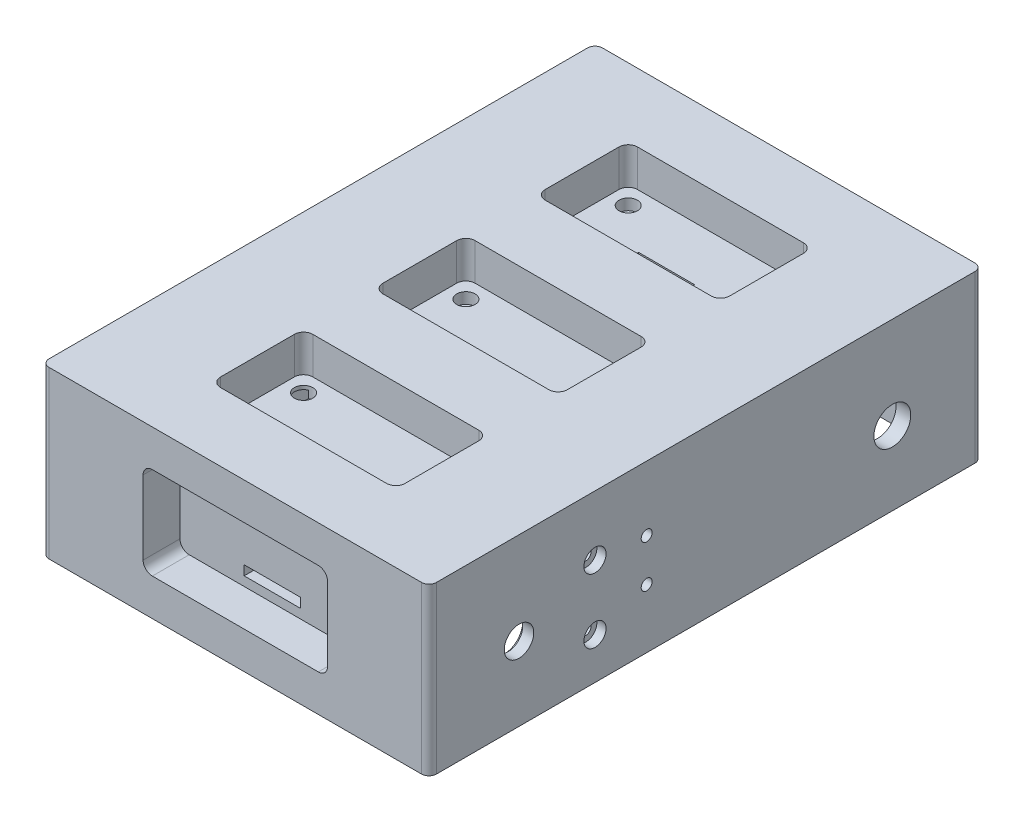
from build123d import *

# Parameters (mm, degrees)
SKETCH_1_W           = 105
SKETCH_1_H           = 150
EXTRUDE_1_DEPTH      = 45
CUT_EXTRUDE_1_DEPTH  = 10
CUT_EXTRUDE_2_DEPTH  = 10
SHELL_1_T            = -4
SKETCH_5_R           = 1.45
SKETCH_5_R_2         = 4
SKETCH_5_R_3         = 5
CUT_EXTRUDE_3_DEPTH  = 15
SKETCH_6_R           = 3
CUT_EXTRUDE_4_DEPTH  = 2.5
CUT_EXTRUDE_START    = -3
SKETCH_10_W          = 5
SKETCH_10_H          = 36.5
CUT_EXTRUDE_15_DEPTH = 100.655315425
SKETCH_11_R          = 5
CUT_EXTRUDE_16_DEPTH = 1
SKETCH_12_R          = 1.45
CUT_EXTRUDE_17_DEPTH = 14
SKETCH_25_W          = 25
SKETCH_25_H          = 11
EXTRUDE_2_DEPTH      = 10
SKETCH_13_R          = 1.45
CUT_EXTRUDE_18_DEPTH = 10
SKETCH_14_R          = 1.45
CUT_EXTRUDE_19_DEPTH = 3
SKETCH_15_R          = 2.5
SKETCH_15_W          = 15.2
SKETCH_15_H          = 2.6
CUT_EXTRUDE_20_DEPTH = 3
SKETCH_16_W          = 14
SKETCH_16_H          = 1.8
CUT_EXTRUDE_21_DEPTH = 3
SKETCH_17_R          = 2.5
SKETCH_17_W          = 15.2
SKETCH_17_H          = 2.6
CUT_EXTRUDE_22_DEPTH = 3
SKETCH_18_W          = 14
SKETCH_18_H          = 1.8
CUT_EXTRUDE_23_DEPTH = 3
SKETCH_19_R          = 2.5
SKETCH_19_W          = 15.2
SKETCH_19_H          = 2.6
CUT_EXTRUDE_24_DEPTH = 3
SKETCH_20_W          = 14
SKETCH_20_H          = 1.8
CUT_EXTRUDE_25_DEPTH = 8
SKETCH_21_W          = 9.5
SKETCH_21_H          = 14.5
CUT_EXTRUDE_26_DEPTH = 4
SKETCH_22_R          = 1.425
CUT_EXTRUDE_27_DEPTH = 9
SKETCH_24_R          = 1.475
CUT_EXTRUDE_28_DEPTH = 137.656503687
FILLET_1_R           = 2


with BuildPart() as part:
    # Эскиз1 → Бобышка-Вытянуть1 (new body)
    with BuildSketch(Plane(origin=(0, 0, 0), x_dir=(1, 0, 0), z_dir=(0, 1, 0))):
        Rectangle(SKETCH_1_W, SKETCH_1_H)
    extrude(amount=EXTRUDE_1_DEPTH)

    # Эскиз2 → Вырез-Вытянуть1 (cut)
    with BuildSketch(Plane.XY.offset(75)):
        with BuildLine():
            Line((-22.5, 10), (22.5, 10))
            ThreePointArc((22.5, 10), (24.267766953, 10.732233047), (25, 12.5))
            Line((25, 12.5), (25, 32.5))
            ThreePointArc((25, 32.5), (24.267766953, 34.267766953), (22.5, 35))
            Line((22.5, 35), (-22.5, 35))
            ThreePointArc((-22.5, 35), (-24.267766953, 34.267766953), (-25, 32.5))
            Line((-25, 32.5), (-25, 12.5))
            ThreePointArc((-25, 12.5), (-24.267766953, 10.732233047), (-22.5, 10))
        make_face()
    cut_extrude_1 = extrude(amount=-CUT_EXTRUDE_1_DEPTH, mode=Mode.SUBTRACT)

    # Эскиз4 → Вырез-Вытянуть2 (cut)
    with BuildSketch(Plane(origin=(0, 45, 0), x_dir=(1, 0, 0), z_dir=(0, 1, 0))):
        with BuildLine():
            Line((-22.5, 31.5), (22.5, 31.5))
            ThreePointArc((22.5, 31.5), (24.267766953, 32.232233047), (25, 34))
            Line((25, 34), (25, 54))
            ThreePointArc((25, 54), (24.267766953, 55.767766953), (22.5, 56.5))
            Line((22.5, 56.5), (-22.5, 56.5))
            ThreePointArc((-22.5, 56.5), (-24.267766953, 55.767766953), (-25, 54))
            Line((-25, 54), (-25, 34))
            ThreePointArc((-25, 34), (-24.267766953, 32.232233047), (-22.5, 31.5))
        make_face()
        with BuildLine():
            Line((-22.5, -12.5), (22.5, -12.5))
            ThreePointArc((22.5, -12.5), (24.267766953, -11.767766953), (25, -10))
            Line((25, -10), (25, 10))
            ThreePointArc((25, 10), (24.267766953, 11.767766953), (22.5, 12.5))
            Line((22.5, 12.5), (-22.5, 12.5))
            ThreePointArc((-22.5, 12.5), (-24.267766953, 11.767766953), (-25, 10))
            Line((-25, 10), (-25, -10))
            ThreePointArc((-25, -10), (-24.267766953, -11.767766953), (-22.5, -12.5))
        make_face()
        with BuildLine():
            Line((-22.5, -56.5), (22.5, -56.5))
            ThreePointArc((22.5, -56.5), (24.267766953, -55.767766953), (25, -54))
            Line((25, -54), (25, -34))
            ThreePointArc((25, -34), (24.267766953, -32.232233047), (22.5, -31.5))
            Line((22.5, -31.5), (-22.5, -31.5))
            ThreePointArc((-22.5, -31.5), (-24.267766953, -32.232233047), (-25, -34))
            Line((-25, -34), (-25, -54))
            ThreePointArc((-25, -54), (-24.267766953, -55.767766953), (-22.5, -56.5))
        make_face()
    extrude(amount=-CUT_EXTRUDE_2_DEPTH, mode=Mode.SUBTRACT)

    # Зеркальное отражение1: Вырез-Вытянуть1 across plane
    add(cut_extrude_1.mirror(Plane.XY), mode=Mode.SUBTRACT)

    # Оболочка1
    shell_1_openings = [part.faces().sort_by_distance(p)[0] for p in [
        (0, 0, 0),
    ]]
    offset(amount=SHELL_1_T, openings=shell_1_openings, kind=Kind.INTERSECTION)

    # Эскиз5 → Вырез-Вытянуть3 (cut)
    with BuildSketch(Plane.ZY.offset(52.5)):
        with Locations((30, 28.75)):
            Circle(SKETCH_5_R)
        with Locations((30, 11.25)):
            Circle(SKETCH_5_R)
        with Locations((50.6, 20)):
            Circle(SKETCH_5_R_2)
        with Locations((-50.6, 20)):
            Circle(SKETCH_5_R_3)
    cut_extrude_3 = extrude(amount=-CUT_EXTRUDE_3_DEPTH, mode=Mode.SUBTRACT)

    # Эскиз6 → Вырез-Вытянуть4 (cut)
    with BuildSketch(Plane.ZY.offset(52.5)):
        with Locations((30, 28.75)):
            Circle(SKETCH_6_R)
        with Locations((30, 11.25)):
            Circle(SKETCH_6_R)
    cut_extrude_4 = extrude(amount=-CUT_EXTRUDE_4_DEPTH, mode=Mode.SUBTRACT)

    # Эскиз10 → Вырез-Вытянуть15 (cut)
    with BuildSketch(Plane(origin=(0, 31, 0), x_dir=(-1, 0, 0), z_dir=(0, -1, 0)).offset(CUT_EXTRUDE_START)):
        with Locations((23.5, -45.75)):
            Rectangle(SKETCH_10_W, SKETCH_10_H)
    cut_extrude_15 = extrude(amount=CUT_EXTRUDE_15_DEPTH, mode=Mode.SUBTRACT)

    # Эскиз11 → Вырез-Вытянуть16 (cut)
    with BuildSketch(Plane(origin=(-48.5, 0, 0), x_dir=(0, 0, -1), z_dir=(1, 0, 0))):
        with Locations((-50.6, 20)):
            Circle(SKETCH_11_R)
    cut_extrude_16 = extrude(amount=-CUT_EXTRUDE_16_DEPTH, mode=Mode.SUBTRACT)

    # Зеркальное отражение2: Вырез-Вытянуть3, Вырез-Вытянуть4, Вырез-Вытянуть15, Вырез-Вытянуть16 across plane
    add(cut_extrude_3.mirror(Plane(origin=(0, 0, 0), x_dir=(0, 0, 1), z_dir=(1, 0, 0))), mode=Mode.SUBTRACT)
    add(cut_extrude_4.mirror(Plane(origin=(0, 0, 0), x_dir=(0, 0, 1), z_dir=(1, 0, 0))), mode=Mode.SUBTRACT)
    add(cut_extrude_15.mirror(Plane(origin=(0, 0, 0), x_dir=(0, 0, 1), z_dir=(1, 0, 0))), mode=Mode.SUBTRACT)
    add(cut_extrude_16.mirror(Plane(origin=(0, 0, 0), x_dir=(0, 0, 1), z_dir=(1, 0, 0))), mode=Mode.SUBTRACT)

    # Эскиз12 → Вырез-Вытянуть17 (cut)
    with BuildSketch(Plane(origin=(0, 6, 0), x_dir=(-1, 0, 0), z_dir=(0, -1, 0))):
        with Locations(Location((-10, -63, 0), (0, 0, 90))):
            Circle(SKETCH_12_R)
        with Locations(Location((10, -63, 0), (0, 0, 90))):
            Circle(SKETCH_12_R)
    extrude(amount=-CUT_EXTRUDE_17_DEPTH, mode=Mode.SUBTRACT)

    # Эскиз25 → Бобышка-Вытянуть2 (add)
    with BuildSketch(Plane.XZ.offset(-31)):
        with Locations((0, 22)):
            Rectangle(SKETCH_25_W, SKETCH_25_H)
    extrude(amount=-EXTRUDE_2_DEPTH)

    # Эскиз13 → Вырез-Вытянуть18 (cut)
    with BuildSketch(Plane(origin=(0, 31, 0), x_dir=(-1, 0, 0), z_dir=(0, -1, 0))):
        with Locations(Location((-9, -25.5, 0), (0, 0, 90))):
            Circle(SKETCH_13_R)
        with Locations(Location((9, -25.5, 0), (0, 0, 90))):
            Circle(SKETCH_13_R)
    extrude(amount=-CUT_EXTRUDE_18_DEPTH, mode=Mode.SUBTRACT)

    # Эскиз14 → Вырез-Вытянуть19 (cut)
    with BuildSketch(Plane(origin=(0, 31, 0), x_dir=(-1, 0, 0), z_dir=(0, -1, 0))):
        with Locations(Location((20, 47.5, 0), (0, 0, 90))):
            Circle(SKETCH_14_R)
        with Locations(Location((20, -7.5, 0), (0, 0, 90))):
            Circle(SKETCH_14_R)
        with Locations(Location((-20, -7.5, 0), (0, 0, 270))):
            Circle(SKETCH_14_R)
        with Locations(Location((-20, 47.5, 0), (0, 0, 270))):
            Circle(SKETCH_14_R)
    extrude(amount=-CUT_EXTRUDE_19_DEPTH, mode=Mode.SUBTRACT)

    # Эскиз15 → Вырез-Вытянуть20 (cut)
    with BuildSketch(Plane(origin=(0, 35, 0), x_dir=(1, 0, 0), z_dir=(0, 1, 0))):
        with Locations(Location((-20, -36.5, 0), (0, 0, 270))):
            Circle(SKETCH_15_R)
        with Locations(Location((20, -36.5, 0), (0, 0, 270))):
            Circle(SKETCH_15_R)
        with Locations(Location((-20, 7.5, 0), (0, 0, 270))):
            Circle(SKETCH_15_R)
        with Locations(Location((20, 7.5, 0), (0, 0, 270))):
            Circle(SKETCH_15_R)
        with Locations(Location((-20, 51.5, 0), (0, 0, 270))):
            Circle(SKETCH_15_R)
        with Locations(Location((20, 51.5, 0), (0, 0, 270))):
            Circle(SKETCH_15_R)
        with Locations((0, -54)):
            Rectangle(SKETCH_15_W, SKETCH_15_H)
        with Locations((0, -8.7)):
            Rectangle(SKETCH_15_W, SKETCH_15_H)
        with Locations((0, 36.6)):
            Rectangle(SKETCH_15_W, SKETCH_15_H)
        with Locations((0, -50)):
            Rectangle(SKETCH_15_W, SKETCH_15_H)
        with Locations((0, -4.7)):
            Rectangle(SKETCH_15_W, SKETCH_15_H)
        with Locations((0, 40.6)):
            Rectangle(SKETCH_15_W, SKETCH_15_H)
    extrude(amount=-CUT_EXTRUDE_20_DEPTH, mode=Mode.SUBTRACT)

    # Эскиз16 → Вырез-Вытянуть21 (cut)
    with BuildSketch(Plane(origin=(0, 32, 0), x_dir=(1, 0, 0), z_dir=(0, 1, 0))):
        with Locations((0, -54)):
            Rectangle(SKETCH_16_W, SKETCH_16_H)
        with Locations((0, -8.7)):
            Rectangle(SKETCH_16_W, SKETCH_16_H)
        with Locations((0, 36.6)):
            Rectangle(SKETCH_16_W, SKETCH_16_H)
        with Locations((0, -50)):
            Rectangle(SKETCH_16_W, SKETCH_16_H)
        with Locations((0, -4.7)):
            Rectangle(SKETCH_16_W, SKETCH_16_H)
        with Locations((0, 40.6)):
            Rectangle(SKETCH_16_W, SKETCH_16_H)
    extrude(amount=-CUT_EXTRUDE_21_DEPTH, mode=Mode.SUBTRACT)

    # Эскиз17 → Вырез-Вытянуть22 (cut)
    with BuildSketch(Plane.XY.offset(65)):
        with Locations((-20, 30)):
            Circle(SKETCH_17_R)
        with Locations((20, 30)):
            Circle(SKETCH_17_R)
        with Locations((0, 13.8)):
            Rectangle(SKETCH_17_W, SKETCH_17_H)
    extrude(amount=-CUT_EXTRUDE_22_DEPTH, mode=Mode.SUBTRACT)

    # Эскиз18 → Вырез-Вытянуть23 (cut)
    with BuildSketch(Plane.XY.offset(62)):
        with Locations((0, 13.8)):
            Rectangle(SKETCH_18_W, SKETCH_18_H)
    extrude(amount=-CUT_EXTRUDE_23_DEPTH, mode=Mode.SUBTRACT)

    # Эскиз19 → Вырез-Вытянуть24 (cut)
    with BuildSketch(Plane(origin=(0, 0, -65), x_dir=(1, 0, 0), z_dir=(0, 0, -1))):
        with Locations(Location((-20, -15, 0), (0, 0, 270))):
            Circle(SKETCH_19_R)
        with Locations(Location((20, -15, 0), (0, 0, 270))):
            Circle(SKETCH_19_R)
        with Locations((0, -31.2)):
            Rectangle(SKETCH_19_W, SKETCH_19_H)
    extrude(amount=-CUT_EXTRUDE_24_DEPTH, mode=Mode.SUBTRACT)

    # Эскиз20 → Вырез-Вытянуть25 (cut)
    with BuildSketch(Plane(origin=(0, 0, -62), x_dir=(1, 0, 0), z_dir=(0, 0, -1))):
        with Locations((0, -31.2)):
            Rectangle(SKETCH_20_W, SKETCH_20_H)
    extrude(amount=-CUT_EXTRUDE_25_DEPTH, mode=Mode.SUBTRACT)

    # Эскиз21 → Вырез-Вытянуть26 (cut)
    with BuildSketch(Plane(origin=(0, 0, -75), x_dir=(1, 0, 0), z_dir=(0, 0, -1))):
        with Locations((42.5, -22.5)):
            Rectangle(SKETCH_21_W, SKETCH_21_H)
    extrude(amount=-CUT_EXTRUDE_26_DEPTH, mode=Mode.SUBTRACT)

    # Эскиз22 → Вырез-Вытянуть27 (cut)
    with BuildSketch(Plane(origin=(0, 0, 0), x_dir=(-1, 0, 0), z_dir=(0, -1, 0))):
        with Locations(Location((-50.5, -73, 0), (0, 0, 90))):
            Circle(SKETCH_22_R)
        with Locations(Location((-50.5, 73, 0), (0, 0, 90))):
            Circle(SKETCH_22_R)
        with Locations(Location((50.5, 73, 0), (0, 0, 90))):
            Circle(SKETCH_22_R)
        with Locations(Location((50.5, -73, 0), (0, 0, 90))):
            Circle(SKETCH_22_R)
        with Locations(Location((0, 73, 0), (0, 0, 90))):
            Circle(SKETCH_22_R)
        with Locations(Location((0, -73, 0), (0, 0, 90))):
            Circle(SKETCH_22_R)
        with Locations(Location((-50.5, 0, 0), (0, 0, 90))):
            Circle(SKETCH_22_R)
        with Locations(Location((50.5, 0, 0), (0, 0, 90))):
            Circle(SKETCH_22_R)
    extrude(amount=-CUT_EXTRUDE_27_DEPTH, mode=Mode.SUBTRACT)

    # Эскиз24 → Вырез-Вытянуть28 (cut, through all)
    with BuildSketch(Plane.ZY.offset(52.5)):
        with Locations((16, 16)):
            Circle(SKETCH_24_R)
        with Locations((16, 27.5)):
            Circle(SKETCH_24_R)
    extrude(amount=-CUT_EXTRUDE_28_DEPTH, mode=Mode.SUBTRACT)

    # Скругление1
    fillet_1_edges = [part.edges().sort_by_distance(p)[0] for p in [
        (52.5, 22.5, 75),
        (-52.5, 22.5, 75),
        (-52.5, 22.5, -75),
        (52.5, 22.5, -75),
    ]]
    fillet(fillet_1_edges, radius=FILLET_1_R)


solid = part.part
